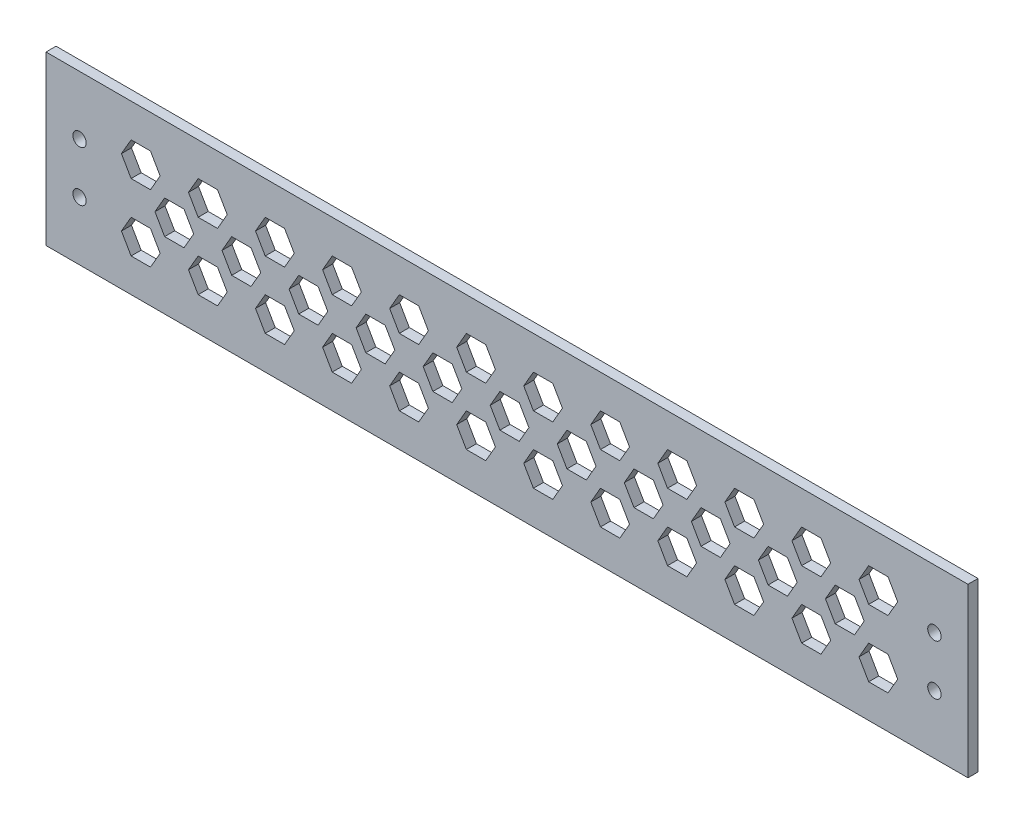
from build123d import *

# Parameters (mm, degrees)
SKETCH1_W           = 275
SKETCH1_H           = 50
SKETCH1_R           = 2
BOSS_EXTRUDE1_DEPTH = 3
CUT_EXTRUDE2_DEPTH  = 3
LPATTERN1_COUNT     = 12
LPATTERN1_PITCH     = 20
CUT_EXTRUDE3_DEPTH  = 3
LPATTERN2_COUNT     = 11
LPATTERN2_PITCH     = 20
CUT_EXTRUDE4_DEPTH  = 3
LPATTERN3_COUNT     = 12
LPATTERN3_PITCH     = 20


with BuildPart() as part:
    # Sketch1 → Boss-Extrude1 (new body)
    with BuildSketch(Plane.XY):
        with Locations((137.5, 25)):
            Rectangle(SKETCH1_W, SKETCH1_H)
        with Locations((10, 32.5)):
            Circle(SKETCH1_R, mode=Mode.SUBTRACT)
        with Locations((10, 17.5)):
            Circle(SKETCH1_R, mode=Mode.SUBTRACT)
        with Locations(Location((265, 17.5, 0), (0, 0, 180))):
            Circle(SKETCH1_R, mode=Mode.SUBTRACT)
        with Locations(Location((265, 32.5, 0), (0, 0, 180))):
            Circle(SKETCH1_R, mode=Mode.SUBTRACT)
    extrude(amount=BOSS_EXTRUDE1_DEPTH)

    # Sketch3 → Cut-Extrude2 (cut)
    with BuildSketch(Plane.XY.offset(3)):
        Polygon((34.047005384, 35), (31.160254038, 40), (25.386751346, 40), (22.5, 35), (25.386751346, 30), (31.160254038, 30), align=None)
    cut_extrude2 = extrude(amount=-CUT_EXTRUDE2_DEPTH, mode=Mode.SUBTRACT)

    # LPattern1: Cut-Extrude2 ×12
    with Locations(*[(i * LPATTERN1_PITCH, 0, 0) for i in range(1, LPATTERN1_COUNT)]):
        add(cut_extrude2, mode=Mode.SUBTRACT)

    # Sketch5 → Cut-Extrude3 (cut)
    with BuildSketch(Plane.XY.offset(3)):
        Polygon((32.5, 25), (35.386751346, 20), (41.160254038, 20), (44.047005384, 25), (41.160254038, 30), (35.386751346, 30), align=None)
    cut_extrude3 = extrude(amount=-CUT_EXTRUDE3_DEPTH, mode=Mode.SUBTRACT)

    # LPattern2: Cut-Extrude3 ×11
    with Locations(*[(i * LPATTERN2_PITCH, 0, 0) for i in range(1, LPATTERN2_COUNT)]):
        add(cut_extrude3, mode=Mode.SUBTRACT)

    # Sketch6 → Cut-Extrude4 (cut)
    with BuildSketch(Plane.XY.offset(3)):
        Polygon((34.047005384, 15), (31.160254038, 20), (25.386751346, 20), (22.5, 15), (25.386751346, 10), (31.160254038, 10), align=None)
    cut_extrude4 = extrude(amount=-CUT_EXTRUDE4_DEPTH, mode=Mode.SUBTRACT)

    # LPattern3: Cut-Extrude4 ×12
    with Locations(*[(i * LPATTERN3_PITCH, 0, 0) for i in range(1, LPATTERN3_COUNT)]):
        add(cut_extrude4, mode=Mode.SUBTRACT)


solid = part.part
